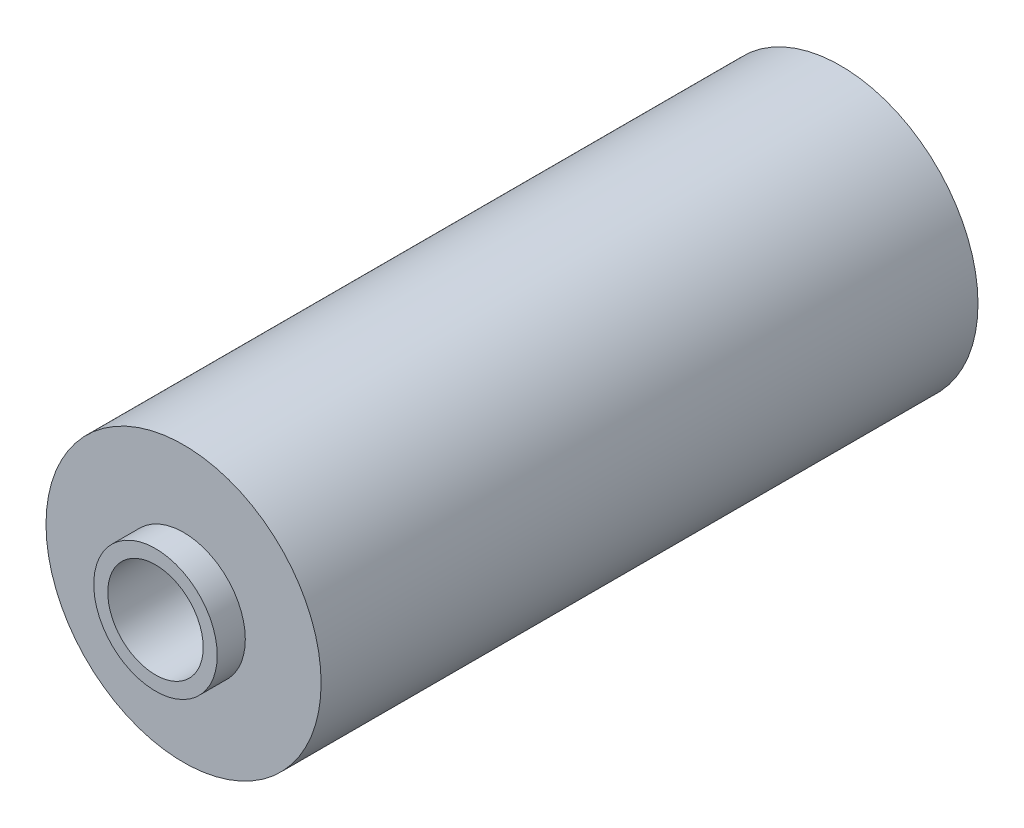
from build123d import *

# Parameters (mm, degrees)
SKETCH1_R           = 4.9
SKETCH1_R_2         = 1.7
BOSS_EXTRUDE1_DEPTH = 23.4
SKETCH2_R           = 2.2
SKETCH2_R_2         = 1.7
BOSS_EXTRUDE2_DEPTH = 1


with BuildPart() as part:
    # Sketch1 → Boss-Extrude1 (new body)
    with BuildSketch(Plane.XY):
        Circle(SKETCH1_R)
        Circle(SKETCH1_R_2, mode=Mode.SUBTRACT)
    extrude(amount=BOSS_EXTRUDE1_DEPTH)

    # Sketch2 → Boss-Extrude2 (add)
    with BuildSketch(Plane.XY.offset(23.4)):
        Circle(SKETCH2_R)
        Circle(SKETCH2_R_2, mode=Mode.SUBTRACT)
    extrude(amount=BOSS_EXTRUDE2_DEPTH)


solid = part.part
